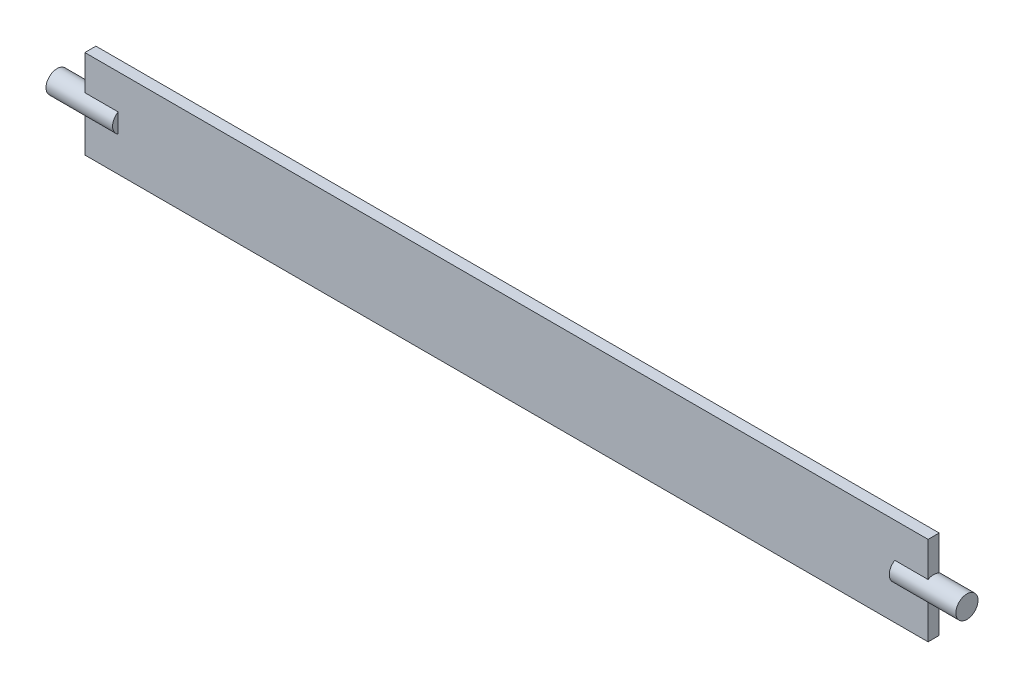
from build123d import *

# Parameters (mm, degrees)
SKETCH1_W           = 380
SKETCH1_H           = 40
BOSS_EXTRUDE1_DEPTH = 5
SKETCH2_R           = 5
BOSS_EXTRUDE2_DEPTH = 15


with BuildPart() as part:
    # Sketch1 → Boss-Extrude1 (new body)
    with BuildSketch(Plane.XY):
        Rectangle(SKETCH1_W, SKETCH1_H)
    extrude(amount=-BOSS_EXTRUDE1_DEPTH)

    # Sketch2 → Boss-Extrude2 (add, symmetric)
    with BuildSketch(Plane.ZY.offset(190)):
        with Locations(Location((-2.5, 0, 0), (0, 0, 120))):
            Circle(SKETCH2_R)
    boss_extrude2 = extrude(amount=BOSS_EXTRUDE2_DEPTH, both=True)

    # Mirror1: Boss-Extrude2 across plane
    add(boss_extrude2.mirror(Plane(origin=(0, 0, 0), x_dir=(0, 0, 1), z_dir=(1, 0, 0))))


solid = part.part
